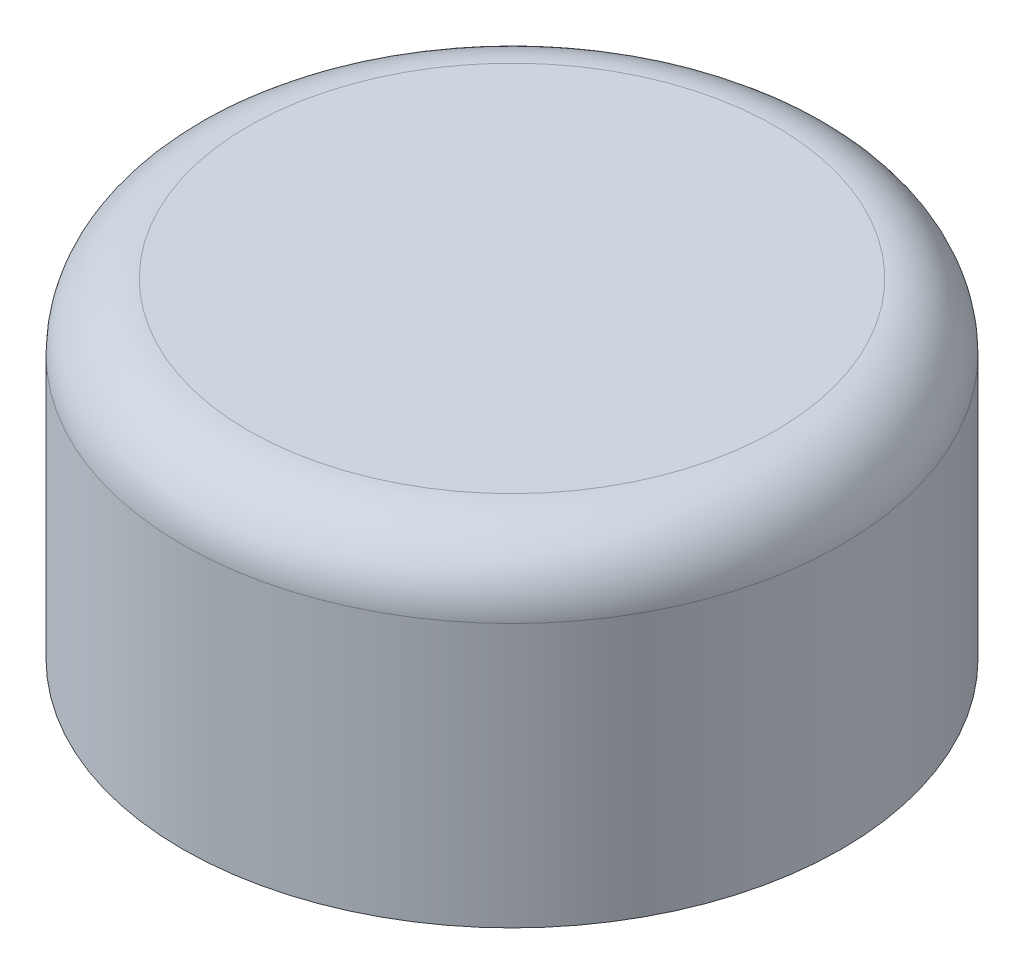
from build123d import *

# Parameters (mm, degrees)
SKETCH1_R           = 5
BOSS_EXTRUDE1_DEPTH = 5
FILLET1_R           = 1
SKETCH2_R           = 3.7
CUT_EXTRUDE1_DEPTH  = 2


with BuildPart() as part:
    # Sketch1 → Boss-Extrude1 (new body)
    with BuildSketch(Plane(origin=(0, 0, 0), x_dir=(1, 0, 0), z_dir=(0, 1, 0))):
        with Locations(Location((0, 0, 0), (0, 0, 270))):
            Circle(SKETCH1_R)
    extrude(amount=BOSS_EXTRUDE1_DEPTH)

    # Fillet1
    fillet1_edges = [part.edges().sort_by_distance(p)[0] for p in [
        (0, 5, -5),
    ]]
    fillet(fillet1_edges, radius=FILLET1_R)

    # Sketch2 → Cut-Extrude1 (cut)
    with BuildSketch(Plane.XZ):
        with Locations(Location((0, 0, 0), (0, 0, 270))):
            Circle(SKETCH2_R)
    extrude(amount=-CUT_EXTRUDE1_DEPTH, mode=Mode.SUBTRACT)


solid = part.part
